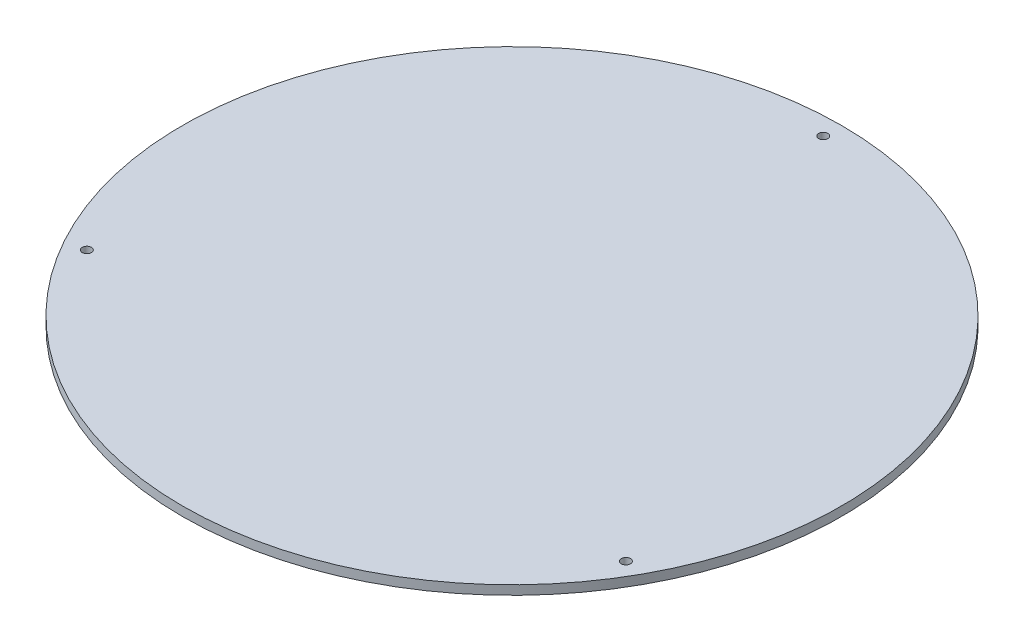
from build123d import *

# Parameters (mm, degrees)
SKETCH1_R               = 228.6
BOSS_EXTRUDE1_DEPTH     = 6.35
CUT_EXTRUDE1_DEPTH      = 324.351577234
CUT_EXTRUDE1_DEPTH_BACK = 324.351577234
SKETCH2_R               = 3.175


with BuildPart() as part:
    # Sketch1 → Boss-Extrude1 (new body)
    with BuildSketch(Plane(origin=(0, 0, 0), x_dir=(1, 0, 0), z_dir=(0, 1, 0))):
        with Locations(Location((0, 0, 0), (0, 0, 270))):
            Circle(SKETCH1_R)
    extrude(amount=BOSS_EXTRUDE1_DEPTH)

    # Sketch2 → Cut-Extrude1 (cut, two sides: drawn at the far end of the back side and taken through both)
    with BuildSketch(Plane(origin=(0, 6.35, 0), x_dir=(1, 0, 0), z_dir=(0, 1, 0)).offset(-CUT_EXTRUDE1_DEPTH_BACK)):
        with Locations(Location((0, 215.9, 0), (0, 0, 270))):
            Circle(SKETCH2_R)
        with Locations(Location((-186.974884677, -107.95, 0), (0, 0, 270))):
            Circle(SKETCH2_R)
        with Locations(Location((186.974884677, -107.95, 0), (0, 0, 270))):
            Circle(SKETCH2_R)
    extrude(amount=CUT_EXTRUDE1_DEPTH + CUT_EXTRUDE1_DEPTH_BACK, mode=Mode.SUBTRACT)


solid = part.part
